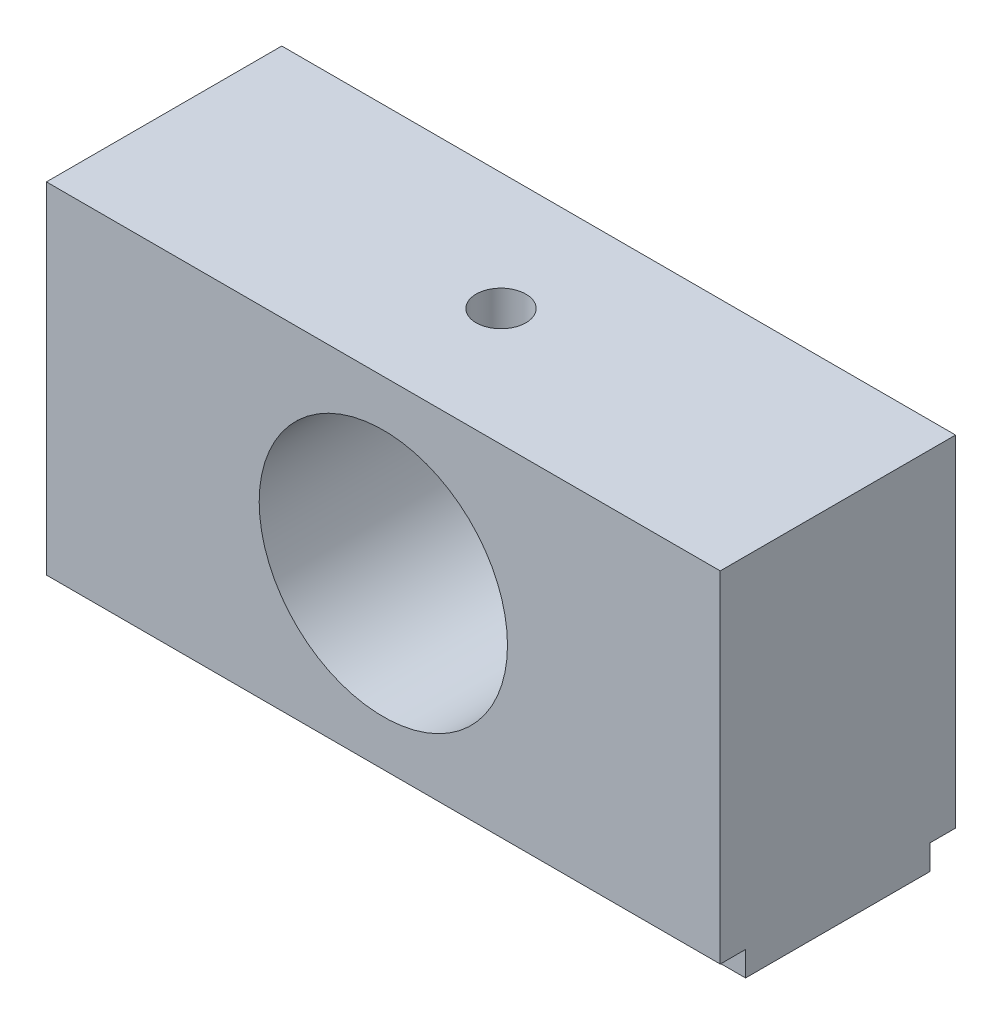
from build123d import *

# Parameters (mm, degrees)
SKETCH1_W                    = 69.088
SKETCH1_H                    = 37.45
EXTRUDE1_DEPTH               = 24.13
CUT_EXTRUDE1_DEPTH           = 8.128
CUT_EXTRUDE1_DEPTH_BACK      = 83.312
CUT_EXTRUDE4_DEPTH           = 25.4
CUT_EXTRUDE4_DEPTH_BACK      = 89.662
SKETCH11_W                   = 7.556551936
SKETCH11_H                   = 2.543
F_5_16_24_TAPPED_HOLE1_D     = 6.9088
F_5_16_24_TAPPED_HOLE1_DEPTH = 19.05254
F_5_16_24_TAPPED_HOLE1_TIP   = 2.075612922
CUT_EXTRUDE5_DEPTH           = 38.608
CUT_EXTRUDE5_DEPTH_BACK      = 11.938
SKETCH15_R                   = 12.72999994
SKETCH16_R                   = 14.7
SKETCH16_R_2                 = 9.7
BOSS_EXTRUDE1_DEPTH          = 4.73
F_1_4_20_TAPPED_HOLE2_D      = 5.1054
F_1_4_20_TAPPED_HOLE2_DEPTH  = 16.51
F_1_4_20_TAPPED_HOLE2_TIP    = 1.533816902


with BuildPart() as part:
    # Sketch1 → Extrude1 (new body)
    with BuildSketch(Plane.XY):
        with Locations((18.406260253, 9.092395655)):
            Rectangle(SKETCH1_W, SKETCH1_H)
    extrude(amount=EXTRUDE1_DEPTH)

    # Sketch2 → Cut-Extrude1 (cut, two sides: drawn at the far end of the back side and taken through both)
    with BuildSketch(Plane.ZY.offset(16.137739747).offset(-CUT_EXTRUDE1_DEPTH_BACK)):
        with BuildLine():
            Line((-1.394410139, -7.219604345), (2.59715, -7.219604345))
            Line((2.59715, -7.219604345), (2.59715, -10.370080057))
            Line((2.59715, -10.370080057), (21.53285, -10.370080057))
            Line((21.53285, -10.370080057), (21.53285, -7.219604345))
            Line((21.53285, -7.219604345), (26.024229083, -7.219604345))
            ThreePointArc((26.024229083, -7.219604345), (12.314909472, -19.255117467), (-1.394410139, -7.219604345))
        make_face()
    extrude(amount=CUT_EXTRUDE1_DEPTH + CUT_EXTRUDE1_DEPTH_BACK, mode=Mode.SUBTRACT)

    # Sketch11 → Cut-Extrude4 (cut, two sides: drawn at the far end of the back side and taken through both)
    with BuildSketch(Plane.ZY.offset(16.137739747).offset(-CUT_EXTRUDE4_DEPTH_BACK)):
        with Locations((-1.181125968, -8.361104345)):
            Rectangle(SKETCH11_W, SKETCH11_H)
        Polygon((21.534784946, -7.096819318), (21.532847251, -9.63981858), (29.089396994, -9.645576459), (29.091334688, -7.102577197), align=None)
    extrude(amount=CUT_EXTRUDE4_DEPTH + CUT_EXTRUDE4_DEPTH_BACK, mode=Mode.SUBTRACT)

    # 5/16-24 Tapped Hole1
    with Locations(Plane(origin=(-3.183739747, -9.632604345, 12.065), x_dir=(0, 0, -1), z_dir=(0, -1, 0))):
        with Locations((0, 0), (0, 43.18)):
            Hole(F_5_16_24_TAPPED_HOLE1_D / 2, depth=F_5_16_24_TAPPED_HOLE1_DEPTH)
            with Locations((0, 0, -(F_5_16_24_TAPPED_HOLE1_DEPTH + F_5_16_24_TAPPED_HOLE1_TIP / 2))):  # 118° drill point
                Cone(0, F_5_16_24_TAPPED_HOLE1_D / 2, F_5_16_24_TAPPED_HOLE1_TIP, mode=Mode.SUBTRACT)

    # Sketch15 → Cut-Extrude5 (cut, two sides: drawn at the far end of the back side and taken through both)
    with BuildSketch(Plane.XY.offset(-CUT_EXTRUDE5_DEPTH_BACK)):
        with Locations(Location((18.406260253, 10.317395655, 0), (0, 0, 180))):
            Circle(SKETCH15_R)
    extrude(amount=CUT_EXTRUDE5_DEPTH + CUT_EXTRUDE5_DEPTH_BACK, mode=Mode.SUBTRACT)

    # Sketch16 → Boss-Extrude1 (add)
    with BuildSketch(Plane.XY.offset(4.73)):
        with Locations((18.406260253, 10.317395655)):
            Circle(SKETCH16_R)
        with Locations((18.406260253, 10.317395655)):
            Circle(SKETCH16_R_2, mode=Mode.SUBTRACT)
    extrude(amount=-BOSS_EXTRUDE1_DEPTH)

    # 1/4-20 Tapped Hole2
    with Locations(Plane(origin=(18.406260253, 27.817395655, 12.065), x_dir=(0, 0, 1), z_dir=(0, 1, 0))):
        with Locations((0, 0)):
            Hole(F_1_4_20_TAPPED_HOLE2_D / 2, depth=F_1_4_20_TAPPED_HOLE2_DEPTH)
            with Locations((0, 0, -(F_1_4_20_TAPPED_HOLE2_DEPTH + F_1_4_20_TAPPED_HOLE2_TIP / 2))):  # 118° drill point
                Cone(0, F_1_4_20_TAPPED_HOLE2_D / 2, F_1_4_20_TAPPED_HOLE2_TIP, mode=Mode.SUBTRACT)


solid = part.part
